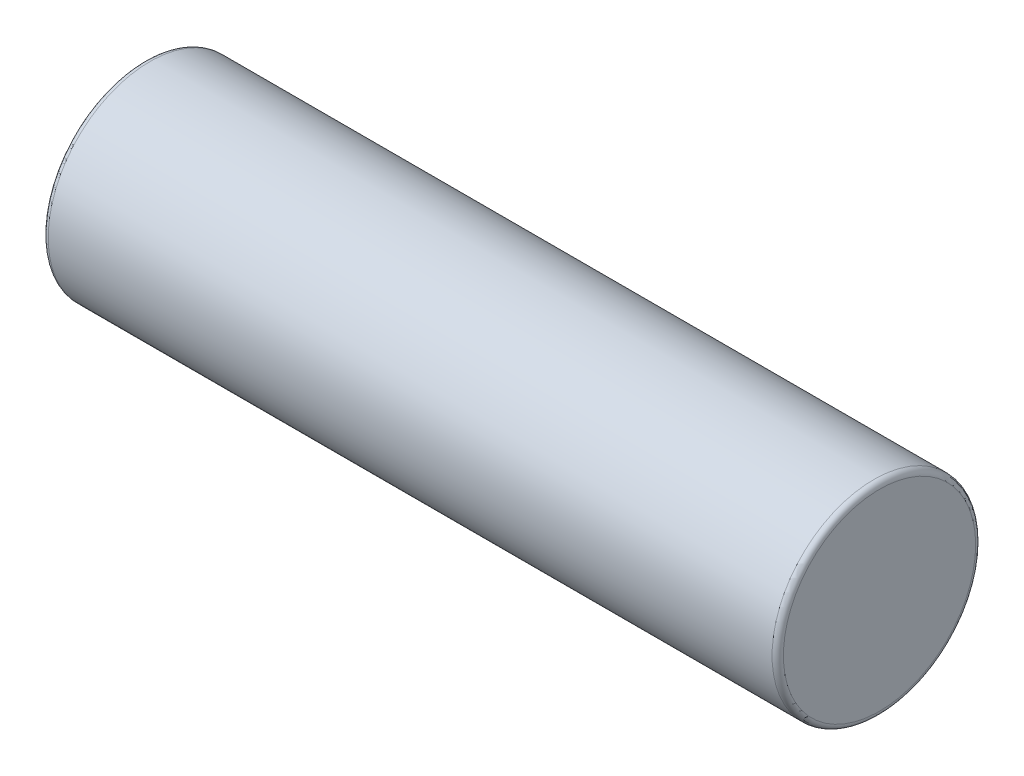
from build123d import *

# Parameters (mm, degrees)
SKETCH_1_R      = 9
EXTRUDE_1_DEPTH = 65
FILLET_1_R      = 0.5


with BuildPart() as part:
    # Эскиз1 → Бобышка-Вытянуть1 (new body)
    with BuildSketch(Plane(origin=(0, 0, 0), x_dir=(0, 0, -1), z_dir=(1, 0, 0))):
        Circle(SKETCH_1_R)
    extrude(amount=EXTRUDE_1_DEPTH)

    # Скругление1
    fillet_1_edges = [part.edges().sort_by_distance(p)[0] for p in [
        (0, 0, 9),
        (65, 0, 9),
    ]]
    fillet(fillet_1_edges, radius=FILLET_1_R)


solid = part.part
